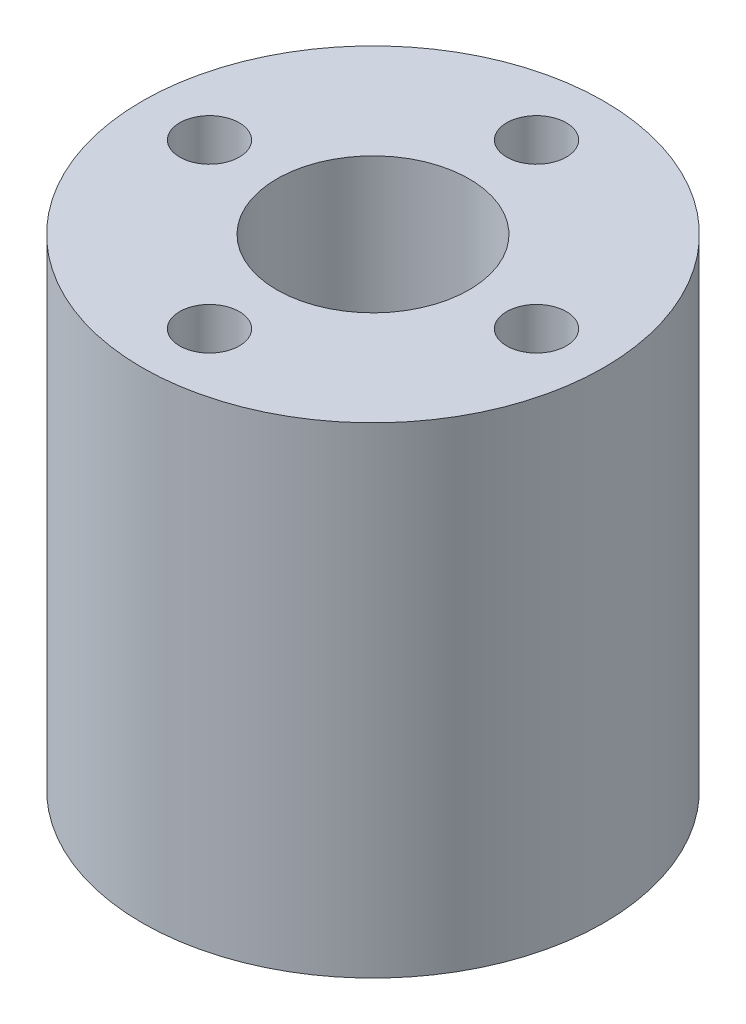
from build123d import *

# Parameters (mm, degrees)
SKETCH1_R           = 12
SKETCH1_R_2         = 1.55
SKETCH1_R_3         = 5
BOSS_EXTRUDE1_DEPTH = 25


with BuildPart() as part:
    # Sketch1 → Boss-Extrude1 (new body)
    with BuildSketch(Plane(origin=(0, 0, 0), x_dir=(1, 0, 0), z_dir=(0, 1, 0))):
        with Locations(Location((0, 0, 0), (0, 0, 270))):
            Circle(SKETCH1_R)
        with Locations(Location((0, 8.5, 0), (0, 0, 270))):
            Circle(SKETCH1_R_2, mode=Mode.SUBTRACT)
        with Locations(Location((8.5, 0, 0), (0, 0, 270))):
            Circle(SKETCH1_R_2, mode=Mode.SUBTRACT)
        with Locations(Location((0, -8.5, 0), (0, 0, 270))):
            Circle(SKETCH1_R_2, mode=Mode.SUBTRACT)
        with Locations(Location((-8.5, 0, 0), (0, 0, 270))):
            Circle(SKETCH1_R_2, mode=Mode.SUBTRACT)
        with Locations(Location((0, 0, 0), (0, 0, 270))):
            Circle(SKETCH1_R_3, mode=Mode.SUBTRACT)
    extrude(amount=BOSS_EXTRUDE1_DEPTH)


solid = part.part
